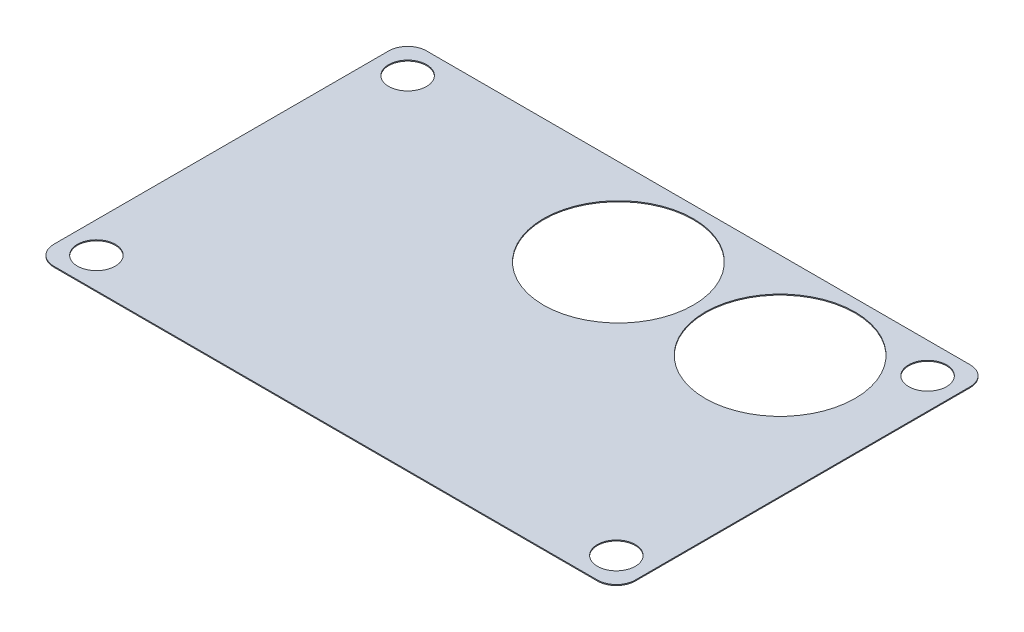
from build123d import *

# Parameters (mm, degrees)
SKETCH1_W               = 78
SKETCH1_H               = 50
KAPTON_INSULATION_DEPTH = 0.127
EDGE_RADIUS_R           = 2.54
SKETCH3_R               = 2.54
MAGNET_HOLE_DEPTH       = 93.649965618
MIRROR2_COPY_1_SKETCH_R = 2.54
MIRROR2_COPY_1_DEPTH    = 93.649965618
SKETCH4_R               = 10.05
CUT_EXTRUDE2_DEPTH      = 93.649965618


with BuildPart() as part:
    # Sketch1 → kapton_insulation (new body)
    with BuildSketch(Plane(origin=(0, 0, 0), x_dir=(1, 0, 0), z_dir=(0, 1, 0))):
        with Locations((39, 25)):
            Rectangle(SKETCH1_W, SKETCH1_H)
    extrude(amount=KAPTON_INSULATION_DEPTH)

    # edge_radius
    edge_radius_edges = [part.edges().sort_by_distance(p)[0] for p in [
        (0, 0.0635, -50),
        (78, 0.0635, -50),
        (78, 0.0635, 0),
        (0, 0.0635, 0),
    ]]
    fillet(edge_radius_edges, radius=EDGE_RADIUS_R)

    # Sketch3 → magnet_hole (cut, through all)
    with BuildSketch(Plane(origin=(0, 0.127, 0), x_dir=(1, 0, 0), z_dir=(0, 1, 0))):
        with Locations(Location((4.1275, 4.1275, 0), (0, 0, 270))):
            Circle(SKETCH3_R)
    magnet_hole = extrude(amount=-MAGNET_HOLE_DEPTH, mode=Mode.SUBTRACT)

    # Mirror1: magnet_hole across plane
    add(magnet_hole.mirror(Plane.XY.offset(-25)), mode=Mode.SUBTRACT)

    # Mirror2: magnet_hole across plane
    add(magnet_hole.mirror(Plane(origin=(39, 0, 0), x_dir=(0, 0, 1), z_dir=(1, 0, 0))), mode=Mode.SUBTRACT)

    # Mirror2 copy 1 sketch → Mirror2 copy 1 (cut, through all)
    with BuildSketch(Plane(origin=(78, 0.127, -50), x_dir=(-1, 0, 0), z_dir=(0, 1, 0))):
        with Locations(Location((4.1275, 4.1275, 0), (0, 0, 270))):
            Circle(MIRROR2_COPY_1_SKETCH_R)
    extrude(amount=-MIRROR2_COPY_1_DEPTH, mode=Mode.SUBTRACT)

    # Sketch4 → Cut-Extrude2 (cut, through all)
    with BuildSketch(Plane(origin=(0, 0.127, 0), x_dir=(1, 0, 0), z_dir=(0, 1, 0))):
        with Locations(Location((61.6, 38.3625, 0), (0, 0, 270))):
            Circle(SKETCH4_R)
        with Locations(Location((39.9125, 38.3625, 0), (0, 0, 270))):
            Circle(SKETCH4_R)
    extrude(amount=-CUT_EXTRUDE2_DEPTH, mode=Mode.SUBTRACT)


solid = part.part
